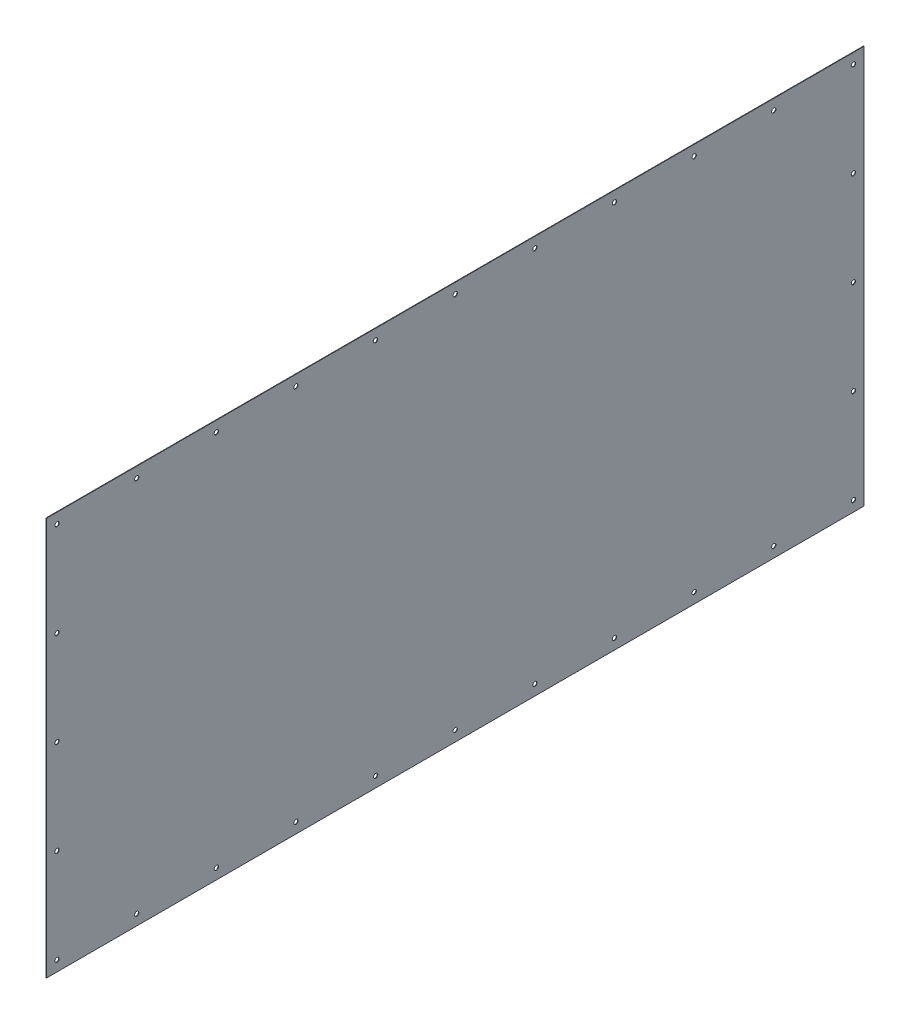
from build123d import *

# Parameters (mm, degrees)
SKETCH1_W           = 1559.92
SKETCH1_H           = 759.96
SKETCH1_R           = 4.1
BOSS_EXTRUDE1_DEPTH = 1


with BuildPart() as part:
    # Sketch1 → Boss-Extrude1 (new body)
    with BuildSketch(Plane(origin=(0, 0, 0), x_dir=(0, 0, -1), z_dir=(1, 0, 0))):
        Rectangle(SKETCH1_W, SKETCH1_H)
        with Locations((-759.96, 359.98)):
            Circle(SKETCH1_R, mode=Mode.SUBTRACT)
        with Locations((-759.96, -359.98)):
            Circle(SKETCH1_R, mode=Mode.SUBTRACT)
        with Locations((-607.97, 359.98)):
            Circle(SKETCH1_R, mode=Mode.SUBTRACT)
        with Locations((-607.97, -359.98)):
            Circle(SKETCH1_R, mode=Mode.SUBTRACT)
        with Locations((-455.98, 359.98)):
            Circle(SKETCH1_R, mode=Mode.SUBTRACT)
        with Locations((-455.98, -359.98)):
            Circle(SKETCH1_R, mode=Mode.SUBTRACT)
        with Locations((-303.99, 359.98)):
            Circle(SKETCH1_R, mode=Mode.SUBTRACT)
        with Locations((-303.99, -359.98)):
            Circle(SKETCH1_R, mode=Mode.SUBTRACT)
        with Locations((-152, 359.98)):
            Circle(SKETCH1_R, mode=Mode.SUBTRACT)
        with Locations((-152, -359.98)):
            Circle(SKETCH1_R, mode=Mode.SUBTRACT)
        with Locations((-0.01, 359.98)):
            Circle(SKETCH1_R, mode=Mode.SUBTRACT)
        with Locations((-0.01, -359.98)):
            Circle(SKETCH1_R, mode=Mode.SUBTRACT)
        with Locations((151.98, 359.98)):
            Circle(SKETCH1_R, mode=Mode.SUBTRACT)
        with Locations((151.98, -359.98)):
            Circle(SKETCH1_R, mode=Mode.SUBTRACT)
        with Locations((303.97, 359.98)):
            Circle(SKETCH1_R, mode=Mode.SUBTRACT)
        with Locations((303.97, -359.98)):
            Circle(SKETCH1_R, mode=Mode.SUBTRACT)
        with Locations((455.96, 359.98)):
            Circle(SKETCH1_R, mode=Mode.SUBTRACT)
        with Locations((455.96, -359.98)):
            Circle(SKETCH1_R, mode=Mode.SUBTRACT)
        with Locations((607.95, 359.98)):
            Circle(SKETCH1_R, mode=Mode.SUBTRACT)
        with Locations((607.95, -359.98)):
            Circle(SKETCH1_R, mode=Mode.SUBTRACT)
        with Locations((759.94, 359.98)):
            Circle(SKETCH1_R, mode=Mode.SUBTRACT)
        with Locations((759.94, -359.98)):
            Circle(SKETCH1_R, mode=Mode.SUBTRACT)
        with Locations((-759.96, 179.990000139)):
            Circle(SKETCH1_R, mode=Mode.SUBTRACT)
        with Locations((-759.96, 0)):
            Circle(SKETCH1_R, mode=Mode.SUBTRACT)
        with Locations((-759.96, -179.990000139)):
            Circle(SKETCH1_R, mode=Mode.SUBTRACT)
        with Locations((759.96, 0)):
            Circle(SKETCH1_R, mode=Mode.SUBTRACT)
        with Locations((759.96, 179.990000139)):
            Circle(SKETCH1_R, mode=Mode.SUBTRACT)
        with Locations((759.96, -179.990000139)):
            Circle(SKETCH1_R, mode=Mode.SUBTRACT)
    extrude(amount=BOSS_EXTRUDE1_DEPTH)


solid = part.part
